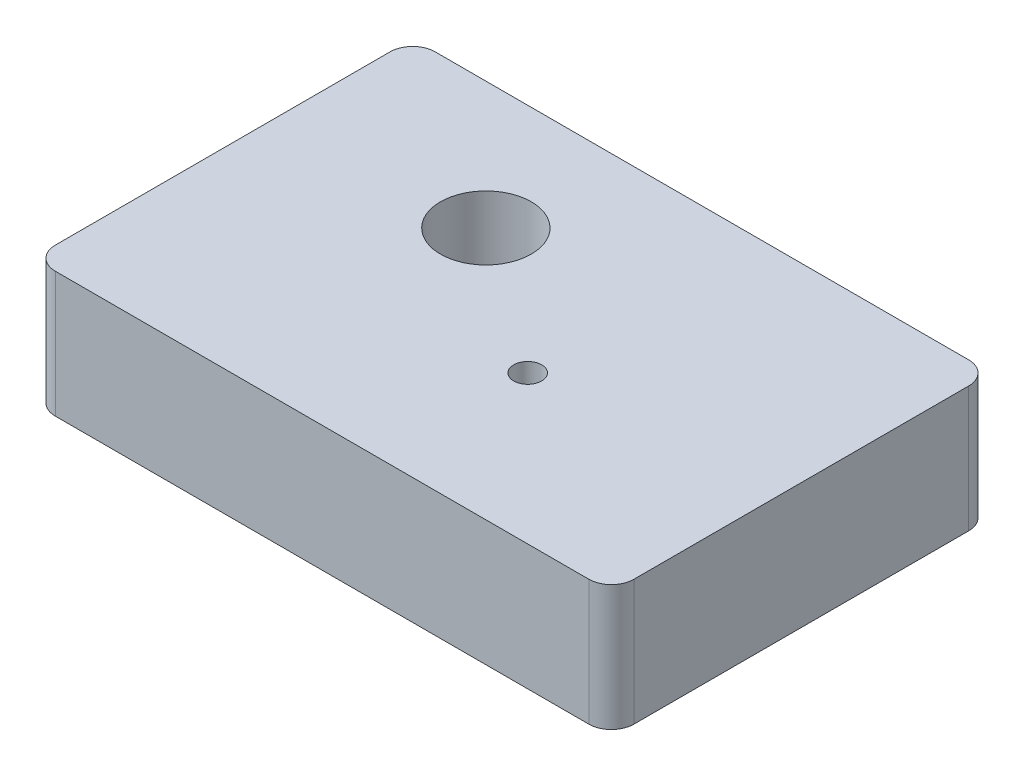
from build123d import *

# Parameters (mm, degrees)
SKETCH1_W           = 27.5
SKETCH1_H           = 18
SKETCH1_R           = 2.25
SKETCH1_R_2         = 0.75
BOSS_EXTRUDE1_DEPTH = 6
FILLET1_R           = 1
MOVE_FACE1_BY       = 0.08
MOVE_FACE1_2_BY     = 0.08
MOVE_FACE1_3_BY     = 0.08
MOVE_FACE1_4_BY     = 0.08
MOVE_FACE1_5_BY     = 0.08
MOVE_FACE1_6_BY     = 0.08
MOVE_FACE1_7_BY     = 0.08
MOVE_FACE1_8_BY     = 0.08
MOVE_FACE1_9_BY     = 0.08
MOVE_FACE1_10_BY    = 0.08


with BuildPart() as part:
    # Sketch1 → Boss-Extrude1 (new body)
    with BuildSketch(Plane(origin=(0, 0, 0), x_dir=(1, 0, 0), z_dir=(0, 1, 0))):
        with Locations((13.75, 9)):
            Rectangle(SKETCH1_W, SKETCH1_H)
        with Locations(Location((9.5, 12, 0), (0, 0, 270))):
            Circle(SKETCH1_R, mode=Mode.SUBTRACT)
        with Locations(Location((16.5, 7, 0), (0, 0, 270))):
            Circle(SKETCH1_R_2, mode=Mode.SUBTRACT)
    extrude(amount=BOSS_EXTRUDE1_DEPTH)

    # Fillet1
    fillet1_edges = [part.edges().sort_by_distance(p)[0] for p in [
        (0, 3, -18),
        (27.5, 3, -18),
        (27.5, 3, 0),
        (0, 3, 0),
    ]]
    fillet(fillet1_edges, radius=FILLET1_R)

    # Move Face1: a curved face moved outward by 0.08
    add(Solid.thicken(part.faces().sort_by_distance((16.5, 3, -7.75))[0], MOVE_FACE1_BY))

    # Move Face1 2: a curved face moved outward by 0.08
    add(Solid.thicken(part.faces().sort_by_distance((9.5, 3, -14.25))[0], MOVE_FACE1_2_BY))

    # Move Face1 3: a curved face moved outward by 0.08
    add(Solid.thicken(part.faces().sort_by_distance((0.292893219, 3, -0.292893219))[0], MOVE_FACE1_3_BY))

    # Move Face1 4: a face moved outward by 0.08
    extrude(part.faces().sort_by_distance((0, 3, -9))[0], amount=MOVE_FACE1_4_BY, dir=(-1, 0, 0))

    # Move Face1 5: a curved face moved outward by 0.08
    add(Solid.thicken(part.faces().sort_by_distance((0.292893219, 3, -17.707106781))[0], MOVE_FACE1_5_BY))

    # Move Face1 6: a face moved outward by 0.08
    extrude(part.faces().sort_by_distance((13.75, 3, -18))[0], amount=MOVE_FACE1_6_BY, dir=(0, 0, -1))

    # Move Face1 7: a curved face moved outward by 0.08
    add(Solid.thicken(part.faces().sort_by_distance((27.207106781, 3, -17.707106781))[0], MOVE_FACE1_7_BY))

    # Move Face1 8: a face moved outward by 0.08
    extrude(part.faces().sort_by_distance((27.5, 3, -9))[0], amount=MOVE_FACE1_8_BY, dir=(1, 0, 0))

    # Move Face1 9: a curved face moved outward by 0.08
    add(Solid.thicken(part.faces().sort_by_distance((27.207106781, 3, -0.292893219))[0], MOVE_FACE1_9_BY))

    # Move Face1 10: a face moved outward by 0.08
    extrude(part.faces().sort_by_distance((13.75, 3, 0))[0], amount=MOVE_FACE1_10_BY, dir=(0, 0, 1))


solid = part.part
